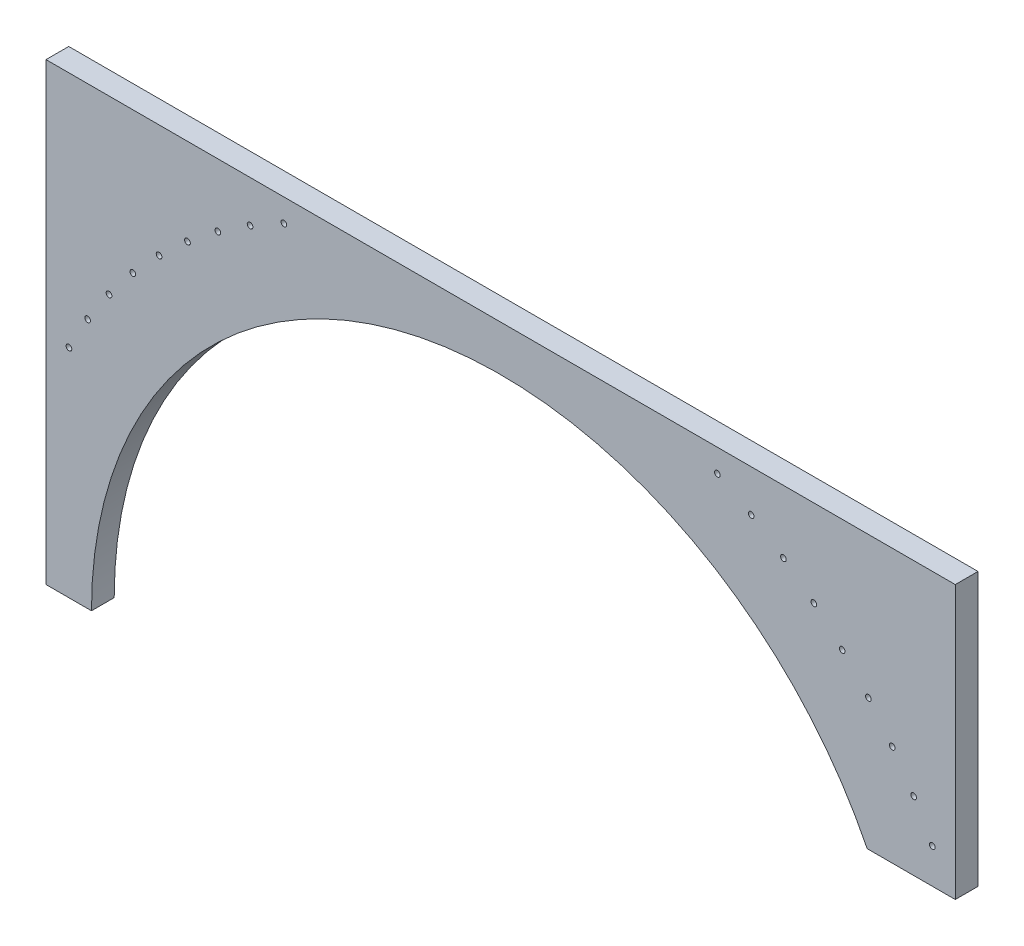
from build123d import *

# Parameters (mm, degrees)
BOSS_EXTRU_1_DEPTH      = 2
ESQUISSE2_R             = 0.25
ENL_V_MAT_EXTRU_1_DEPTH = 2


with BuildPart() as part:
    # Esquisse1 → Boss.-Extru.1 (new body)
    with BuildSketch(Plane.XY):
        with BuildLine():
            Line((40, 16), (40, 40))
            Line((40, 40), (-40, 40))
            Line((-40, 40), (-40, 0))
            Line((-40, 0), (-36, 0))
            ThreePointArc((-36, 0), (-8.216899788, 35.049715518), (32.249030993, 16))
            Line((32.249030993, 16), (40, 16))
        make_face()
    extrude(amount=BOSS_EXTRU_1_DEPTH)

    # Esquisse2 → Enlèv. mat.-Extru.1 (cut)
    with BuildSketch(Plane.XY.offset(2)):
        with Locations((-37.981453947, 19.069849399)):
            Circle(ESQUISSE2_R)
        with Locations((-36.335546301, 22.04491041)):
            Circle(ESQUISSE2_R)
        with Locations((-34.457091159, 24.878883995)):
            Circle(ESQUISSE2_R)
        with Locations((-32.358110634, 27.553632723)):
            Circle(ESQUISSE2_R)
        with Locations((-30.0520382, 30.0520382)):
            Circle(ESQUISSE2_R)
        with Locations((-27.553632723, 32.358110634)):
            Circle(ESQUISSE2_R)
        with Locations((-24.878883995, 34.457091159)):
            Circle(ESQUISSE2_R)
        with Locations((-22.04491041, 36.335546301)):
            Circle(ESQUISSE2_R)
        with Locations((-19.069849399, 37.981453947)):
            Circle(ESQUISSE2_R)
        with Locations(Location((19.069849399, 37.981453947, 0), (0, 0, 180))):
            Circle(ESQUISSE2_R)
        with Locations(Location((22.04491041, 36.335546301, 0), (0, 0, 180))):
            Circle(ESQUISSE2_R)
        with Locations(Location((24.878883995, 34.457091159, 0), (0, 0, 180))):
            Circle(ESQUISSE2_R)
        with Locations(Location((27.553632723, 32.358110634, 0), (0, 0, 180))):
            Circle(ESQUISSE2_R)
        with Locations(Location((30.0520382, 30.0520382, 0), (0, 0, 180))):
            Circle(ESQUISSE2_R)
        with Locations(Location((32.358110634, 27.553632723, 0), (0, 0, 180))):
            Circle(ESQUISSE2_R)
        with Locations(Location((34.457091159, 24.878883995, 0), (0, 0, 180))):
            Circle(ESQUISSE2_R)
        with Locations(Location((36.335546301, 22.04491041, 0), (0, 0, 180))):
            Circle(ESQUISSE2_R)
        with Locations(Location((37.981453947, 19.069849399, 0), (0, 0, 180))):
            Circle(ESQUISSE2_R)
    extrude(amount=-ENL_V_MAT_EXTRU_1_DEPTH, mode=Mode.SUBTRACT)


solid = part.part
